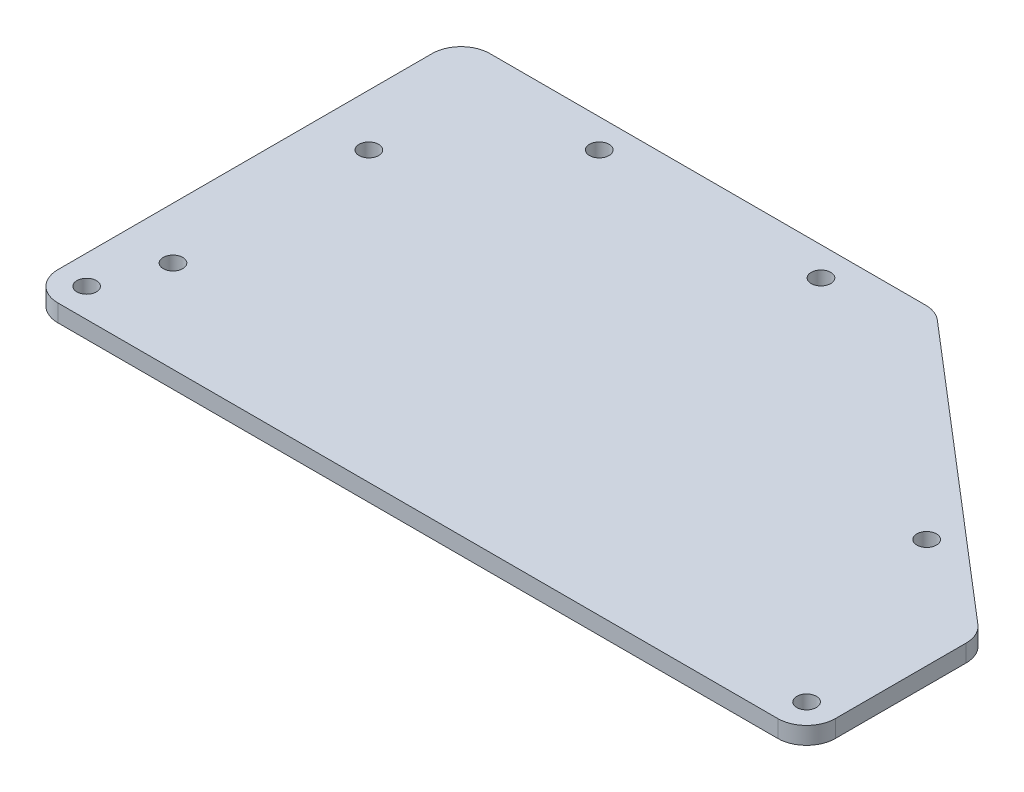
from build123d import *

# Parameters (mm, degrees)
BOSS_EXTRU_1_DEPTH      = 3
CONG_1_R                = 5
ESQUISSE2_R             = 1
ESQUISSE2_R_2           = 1.5
ENL_V_MAT_EXTRU_2_DEPTH = 3
D_GAGEMENT_M31_D        = 3.4
D_GAGEMENT_M31_DEPTH    = 10
D_GAGEMENT_M31_TIP      = 1.021463052


with BuildPart() as part:
    # Esquisse1 → Boss.-Extru.1 (new body)
    with BuildSketch(Plane(origin=(0, 0, 0), x_dir=(1, 0, 0), z_dir=(0, 1, 0))):
        Polygon((-67.5, 0), (67.5, 0), (67.5, 30), (15, 75), (-15, 75), (-67.5, 75), (-67.5, 30), align=None)
    extrude(amount=BOSS_EXTRU_1_DEPTH)

    # Congé1
    cong_1_edges = [part.edges().sort_by_distance(p)[0] for p in [
        (67.5, 1.5, 0),
        (-67.5, 1.5, 0),
        (-67.5, 1.5, -75),
        (15, 1.5, -75),
        (67.5, 1.5, -30),
    ]]
    fillet(cong_1_edges, radius=CONG_1_R)

    # Esquisse2 → Enlèv. mat.-Extru.2 (cut)
    with BuildSketch(Plane(origin=(0, 3, 0), x_dir=(1, 0, 0), z_dir=(0, 1, 0))):
        with Locations(Location((-62.5, 5, 0), (0, 0, 270))):
            Circle(ESQUISSE2_R)
        with Locations(Location((62.5, 5, 0), (0, 0, 270))):
            Circle(ESQUISSE2_R)
        with Locations(Location((0, 70, 0), (0, 0, 270))):
            Circle(ESQUISSE2_R)
        with Locations(Location((-58.5, 15.99, 0), (0, 0, 270))):
            Circle(ESQUISSE2_R_2)
        with Locations(Location((-58.5, 50, 0), (0, 0, 270))):
            Circle(ESQUISSE2_R_2)
        with Locations(Location((-38.5, 70, 0), (0, 0, 270))):
            Circle(ESQUISSE2_R_2)
        with Locations(Location((48.5, 39.85, 0), (0, 0, 270))):
            Circle(ESQUISSE2_R_2)
    extrude(amount=-ENL_V_MAT_EXTRU_2_DEPTH, mode=Mode.SUBTRACT)

    # Dégagement M31
    with Locations(Plane(origin=(0, 3, 0), x_dir=(1, 0, 0), z_dir=(0, 1, 0))):
        with Locations((-62.5, 5), (62.5, 5), (0, 70), (-58.5, 15.99), (-58.5, 50), (-38.5, 70), (48.5, 39.85)):
            Hole(D_GAGEMENT_M31_D / 2, depth=D_GAGEMENT_M31_DEPTH)
            with Locations((0, 0, -(D_GAGEMENT_M31_DEPTH + D_GAGEMENT_M31_TIP / 2))):  # 118° drill point
                Cone(0, D_GAGEMENT_M31_D / 2, D_GAGEMENT_M31_TIP, mode=Mode.SUBTRACT)


solid = part.part
